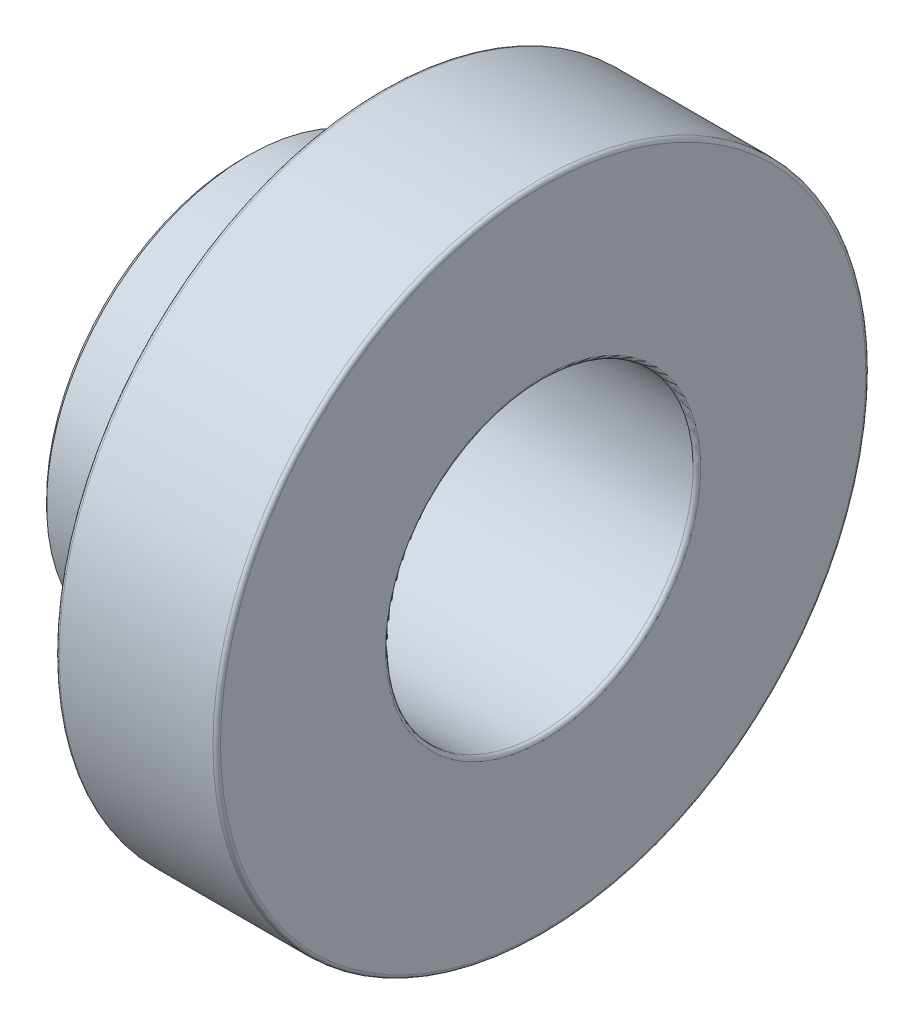
from build123d import *

# Parameters (mm, degrees)
FILLET1_R     = 0.15
FILLET2_R     = 0.15
CHAMFER1_SIZE = 0.2


with BuildPart() as part:
    # Sketch1 → Revolve1 (revolve)
    with BuildSketch(Plane.XY):
        Polygon((0, 12.95), (0, 8), (-5.5, 8), (-5.5, 6.1), (6.4, 6.1), (6.4, 12.95), align=None)
    revolve(axis=Axis((6.4, 0, 0), (-1, 0, 0)))

    # Fillet1
    fillet1_edges = [part.edges().sort_by_distance(p)[0] for p in [
        (0, -12.95, 0),
        (6.4, -12.95, 0),
    ]]
    fillet(fillet1_edges, radius=FILLET1_R)

    # Fillet2
    fillet2_edges = [part.edges().sort_by_distance(p)[0] for p in [
        (6.4, -6.1, 0),
    ]]
    fillet(fillet2_edges, radius=FILLET2_R)

    # Chamfer1
    chamfer1_edges = [part.edges().sort_by_distance(p)[0] for p in [
        (-5.5, -6.1, 0),
        (-5.5, -8, 0),
    ]]
    chamfer(chamfer1_edges, length=CHAMFER1_SIZE)


solid = part.part
